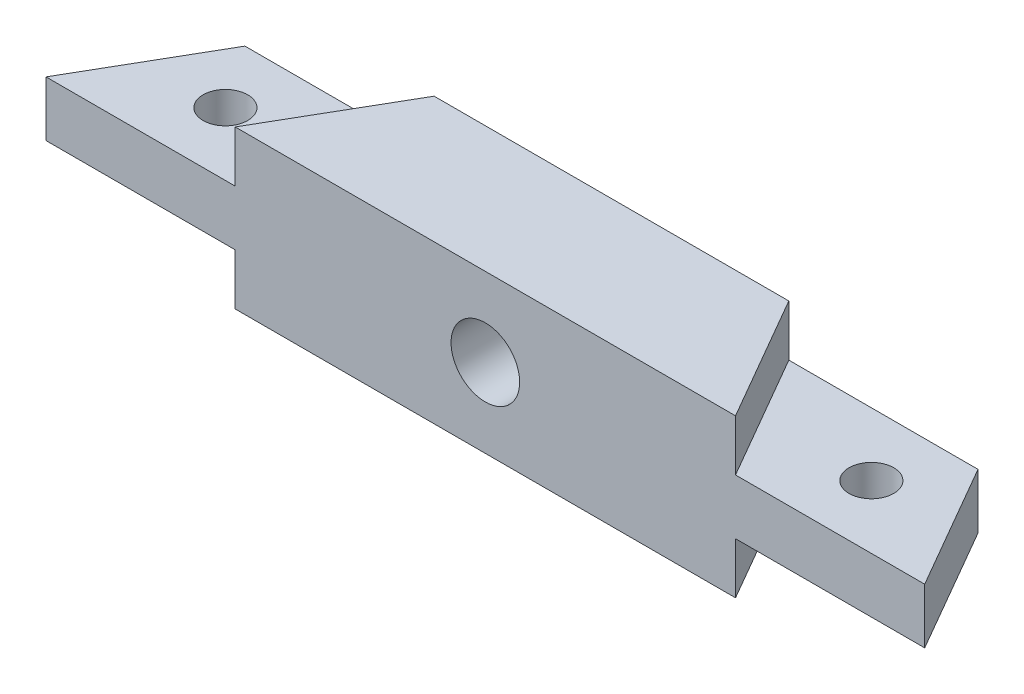
from build123d import *

# Parameters (mm, degrees)
BOSS_EXTRUDE1_DEPTH = 7.9375
SKETCH5_R           = 3.4544
CUT_EXTRUDE2_DEPTH  = 30.30728297
SKETCH6_W           = 19.05
SKETCH6_H           = 5.55625
SKETCH7_W           = 19.05
SKETCH7_H           = 5.55625
CUT_EXTRUDE3_REACH  = 47.962
SKETCH8_R           = 2.2479


with BuildPart() as part:
    # Sketch2 → Boss-Extrude1 (new, symmetric)
    with BuildSketch(Plane(origin=(0, 0, 0), x_dir=(1, 0, 0), z_dir=(0, 1, 0))):
        Polygon((-17.859375, 6.35), (17.859375, 6.35), (25.191723419, -6.35), (-25.191723419, -6.35), align=None)
    extrude(amount=BOSS_EXTRUDE1_DEPTH, both=True)

    # Sketch5 → Cut-Extrude2 (cut, through all)
    with BuildSketch(Plane.XY.offset(6.35)):
        Circle(SKETCH5_R)
    extrude(amount=-CUT_EXTRUDE2_DEPTH, mode=Mode.SUBTRACT)

    # Sweep1: sweep along a curve in space
    with BuildLine() as sweep1_path:
        Line((-17.859375, 7.9375, -6.35), (-25.191723419, 7.9375, 6.35))
    # Sketch6 → Sweep1 (sweep)
    with BuildSketch(Plane.XY.offset(6.35)):
        with Locations((-34.716723419, 0)):
            Rectangle(SKETCH6_W, SKETCH6_H)
    sweep(path=sweep1_path.line)

    # Sweep2: sweep along a curve in space
    with BuildLine() as sweep2_path:
        Line((25.191723419, 7.9375, 6.35), (17.859375, 7.9375, -6.35))
    # Sketch7 → Sweep2 (sweep)
    with BuildSketch(Plane.XY.offset(6.35)):
        with Locations((34.716723419, 0)):
            Rectangle(SKETCH7_W, SKETCH7_H)
    sweep(path=sweep2_path.line)

    # Sketch8 → Cut-Extrude3 (cut, up to next)
    with BuildSketch(Plane(origin=(0, 2.778125, 0), x_dir=(1, 0, 0), z_dir=(0, 1, 0)), mode=Mode.PRIVATE) as cut_extrude3_sk1:
        with Locations(Location((-32.524071837, 0, 0), (0, 0, 180))):
            Circle(SKETCH8_R)
    cut_extrude3_tool1 = extrude(cut_extrude3_sk1.sketch, amount=-CUT_EXTRUDE3_REACH, mode=Mode.PRIVATE) & part.part
    # Sketch8 → Cut-Extrude3 (cut, up to next)
    with BuildSketch(Plane(origin=(0, 2.778125, 0), x_dir=(1, 0, 0), z_dir=(0, 1, 0)), mode=Mode.PRIVATE) as cut_extrude3_sk2:
        with Locations(Location((32.524071837, 0, 0), (0, 0, 180))):
            Circle(SKETCH8_R)
    cut_extrude3_tool2 = extrude(cut_extrude3_sk2.sketch, amount=-CUT_EXTRUDE3_REACH, mode=Mode.PRIVATE) & part.part
    add(cut_extrude3_tool1.solids().sort_by_distance((-32.524072, 2.778125, 0))[0], mode=Mode.SUBTRACT)
    add(cut_extrude3_tool2.solids().sort_by_distance((32.524072, 2.778125, 0))[0], mode=Mode.SUBTRACT)


solid = part.part
